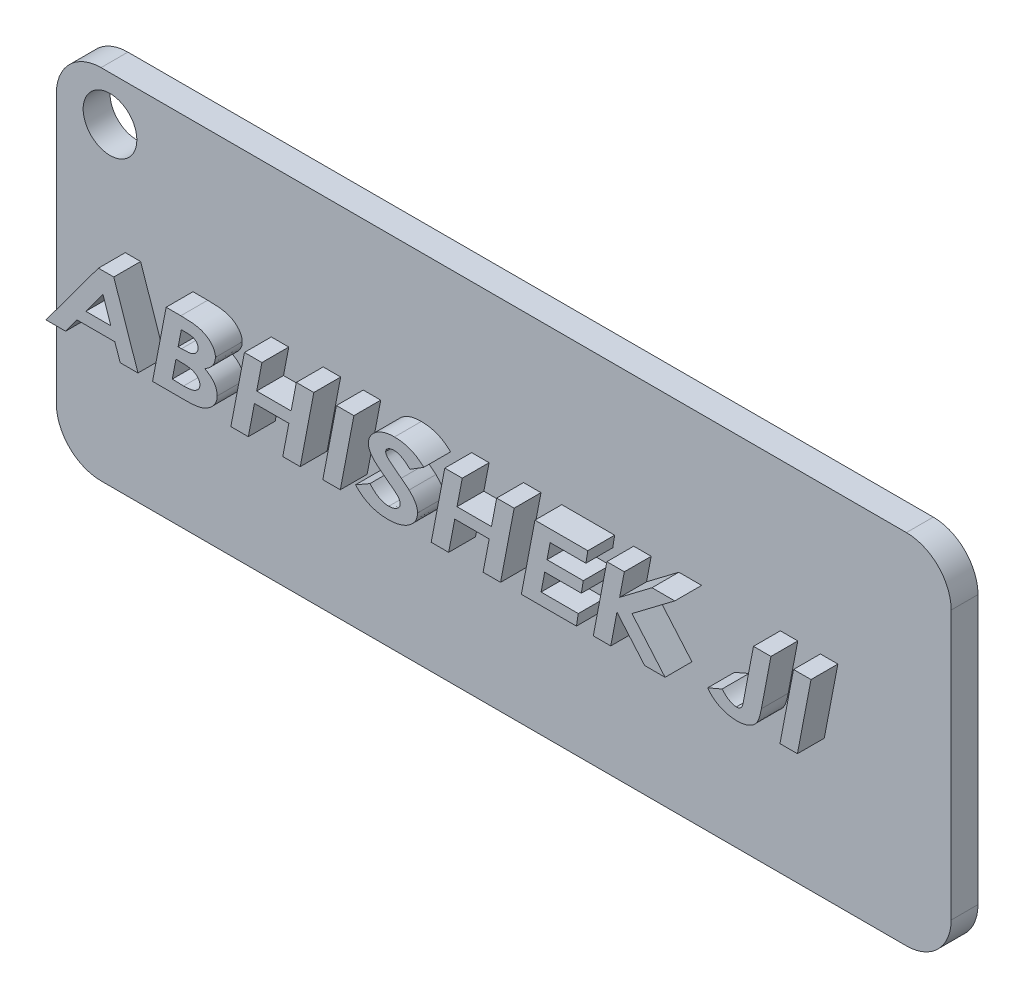
from build123d import *

# Parameters (mm, degrees)
BOSS_EXTRUDE1_DEPTH = 1.5
BOSS_EXTRUDE2_DEPTH = 1.5
SKETCH3_R           = 1.5
CUT_EXTRUDE1_DEPTH  = 1.5


with BuildPart() as part:
    # Sketch1 → Boss-Extrude1 (new body)
    with BuildSketch(Plane.XY):
        with BuildLine():
            Line((-22.5, -10), (22.5, -10))
            ThreePointArc((22.5, -10), (24.267766953, -9.267766953), (25, -7.5))
            Line((25, -7.5), (25, 7.5))
            ThreePointArc((25, 7.5), (24.267766953, 9.267766953), (22.5, 10))
            Line((22.5, 10), (-22.5, 10))
            ThreePointArc((-22.5, 10), (-24.267766953, 9.267766953), (-25, 7.5))
            Line((-25, 7.5), (-25, -7.5))
            ThreePointArc((-25, -7.5), (-24.267766953, -9.267766953), (-22.5, -10))
        make_face()
    extrude(amount=BOSS_EXTRUDE1_DEPTH)

    # Sketch2 → Boss-Extrude2 (add)
    # profile 1 of 10: a face of its own
    with BuildSketch(Plane.XY.offset(1.5)):
        Polygon((-21.146594877, 1.723300812), (-20.289561123, 1.723300812), (-18.937228641, -2.245449188), (-19.934186274, -2.245449188), (-20.228344427, -1.380465214), (-22.340717974, -1.380465214), (-22.979120669, -2.245449188), (-24.076251077, -2.245449188), align=None)
        Polygon((-20.454130685, -0.719006881), (-20.895367914, 0.577674059), (-21.852574445, -0.719006881), align=None, mode=Mode.SUBTRACT)
    # profile 2 of 10: a face of its own
    with BuildSketch(Plane.XY.offset(1.5)):
        with BuildLine():
            Line((-17.363880034, 1.723300812), (-16.541032227, 1.723300812))
            add(Edge.make_bspline(
                [(-16.541032227, 1.723300812), (-16.48033846, 1.723169126), (-16.363153889, 1.722914874), (-16.193512235, 1.716093408), (-16.035804539, 1.706582936), (-15.890079889, 1.694808188), (-15.756542857, 1.676739148), (-15.634915933, 1.656660304), (-15.525161239, 1.632423988), (-15.426479994, 1.603331882), (-15.336365105, 1.570255512), (-15.251696828, 1.533584857), (-15.171304806, 1.492905346), (-15.094798579, 1.448901098), (-15.023554809, 1.399045849), (-14.957168623, 1.344781565), (-14.893624362, 1.287787547), (-14.836314669, 1.225810882), (-14.783663173, 1.161970132), (-14.738246129, 1.09553582), (-14.699206038, 1.028141752), (-14.666968536, 0.959702328), (-14.642960074, 0.889465405), (-14.625804824, 0.818120684), (-14.61371052, 0.745565411), (-14.612776047, 0.696711032), (-14.61230877, 0.672281681)],
                knots=[0, 0, 0, 0, 1.788069285, 3.452317138, 5.001111038, 6.443179535, 7.758358721, 8.970088061, 10.074424941, 11.067590285, 11.998823452, 12.90102893, 13.784457031, 14.652219654, 15.499112109, 16.342939696, 17.177505148, 18.0116322, 18.827432674, 19.613588146, 20.379634812, 21.120189306, 21.838725029, 22.562122777, 23.280997792, 24, 24, 24, 24], degree=3))
            add(Edge.make_bspline(
                [(-14.61230877, 0.672281681), (-14.614126375, 0.631305351), (-14.617747708, 0.549665587), (-14.647738769, 0.429268488), (-14.697171143, 0.313025377), (-14.764786497, 0.200846767), (-14.851350047, 0.095738225), (-14.95505213, -0.000783792), (-15.075175181, -0.089316014), (-15.164732269, -0.138103218), (-15.210960362, -0.163286478)],
                knots=[0, 0, 0, 0, 0.90756848, 1.808206742, 2.732472128, 3.699807128, 4.701884177, 5.741065758, 6.833970308, 8, 8, 8, 8], degree=3))
            add(Edge.make_bspline(
                [(-15.210960362, -0.163286478), (-15.182392977, -0.178557993), (-15.126515237, -0.208429042), (-15.047819073, -0.258559935), (-14.973453665, -0.30890187), (-14.905223749, -0.362647185), (-14.841475106, -0.416921312), (-14.784029487, -0.473709811), (-14.732039486, -0.532159894), (-14.684732423, -0.592179221), (-14.644520582, -0.655555202), (-14.608407515, -0.719809609), (-14.577942738, -0.786228603), (-14.553406862, -0.854621853), (-14.534137827, -0.924788769), (-14.520951891, -0.996895828), (-14.511459128, -1.070684847), (-14.510851843, -1.120727079), (-14.510545949, -1.145933714)],
                knots=[0, 0, 0, 0, 1.219954607, 2.386228456, 3.513383575, 4.601845798, 5.656634142, 6.666225039, 7.642127439, 8.602741412, 9.541575874, 10.466719604, 11.378131008, 12.290853954, 13.201554152, 14.116022893, 15.051027099, 16, 16, 16, 16], degree=3))
            add(Edge.make_bspline(
                [(-14.510545949, -1.145933714), (-14.510995793, -1.172218319), (-14.511890598, -1.22450217), (-14.524054739, -1.30178776), (-14.54086272, -1.377933637), (-14.567068169, -1.451817115), (-14.598517596, -1.524479018), (-14.638159544, -1.595148941), (-14.684922732, -1.663867796), (-14.756296479, -1.75266919), (-14.855594223, -1.856223431), (-14.991524011, -1.962146703), (-15.139778697, -2.052371894), (-15.274838065, -2.111944737), (-15.392074354, -2.151122294), (-15.490155405, -2.176245933), (-15.597654081, -2.197640519), (-15.714482958, -2.214530157), (-15.840340493, -2.229412974), (-15.975684439, -2.23801238), (-16.120390994, -2.245103785), (-16.220097931, -2.245331664), (-16.271519757, -2.245449188)],
                knots=[0, 0, 0, 0, 0.680459984, 1.353532535, 2.023233028, 2.698683934, 3.381358377, 4.073092533, 4.795021277, 5.532942777, 7.023999496, 8.500960618, 9.986185571, 11.511208215, 12.314761941, 13.187612293, 14.133116865, 15.153916582, 16.246036774, 17.416455897, 18.667589635, 20, 20, 20, 20], degree=3))
            Line((-16.271519757, -2.245449188), (-18.123126077, -2.245449188))
            Line((-18.123126077, -2.245449188), (-17.363880034, 1.723300812))
        make_face()
        with BuildLine():
            Line((-16.692086414, 0.145977094), (-16.505256236, 0.145977094))
            add(Edge.make_bspline(
                [(-16.505256236, 0.145977094), (-16.471862219, 0.14608377), (-16.407715195, 0.146288686), (-16.315769581, 0.149096121), (-16.231942824, 0.15151148), (-16.156986081, 0.157542761), (-16.090097509, 0.163462684), (-16.031841355, 0.171660519), (-15.981380259, 0.179516618), (-15.926535697, 0.194620831), (-15.865182692, 0.218152411), (-15.798159002, 0.256475991), (-15.737069454, 0.304983565), (-15.68272328, 0.361863079), (-15.636302386, 0.425151212), (-15.603839136, 0.494374675), (-15.582307677, 0.566587028), (-15.58014691, 0.616211716), (-15.579055565, 0.641275822)],
                knots=[0, 0, 0, 0, 1.353255322, 2.599486752, 3.727981978, 4.751027382, 5.646560469, 6.448528218, 7.135370742, 7.713725776, 8.750824122, 9.789866942, 10.829797453, 11.900818277, 12.970761615, 13.993976123, 14.986810864, 16, 16, 16, 16], degree=3))
            add(Edge.make_bspline(
                [(-15.579055565, 0.641275822), (-15.580031724, 0.664181853), (-15.581957457, 0.70937008), (-15.599972192, 0.774174507), (-15.629392284, 0.834040691), (-15.670279303, 0.887504292), (-15.719316352, 0.935337052), (-15.776603503, 0.974782244), (-15.841207725, 1.004989741), (-15.901082283, 1.023667111), (-15.956413946, 1.035131383), (-16.008012945, 1.041707726), (-16.068971734, 1.04813635), (-16.139476137, 1.053681763), (-16.219807972, 1.057536181), (-16.30967236, 1.059624983), (-16.409052891, 1.061279211), (-16.478489697, 1.061649082), (-16.5147965, 1.061842478)],
                knots=[0, 0, 0, 0, 0.950364965, 1.874847189, 2.771348663, 3.707566675, 4.657867812, 5.60804128, 6.583540349, 7.611183789, 8.207383659, 8.930145273, 9.771859156, 10.755161846, 11.868971456, 13.114029242, 14.490996654, 16, 16, 16, 16], degree=3))
            Line((-16.5147965, 1.061842478), (-16.692086414, 0.145977094))
        make_face(mode=Mode.SUBTRACT)
        with BuildLine():
            Line((-17.020430514, -1.583990855), (-16.387592974, -1.599891296))
            add(Edge.make_bspline(
                [(-16.387592974, -1.599891296), (-16.349157352, -1.599413814), (-16.275146283, -1.598494383), (-16.16824683, -1.592055318), (-16.069230897, -1.581986677), (-15.978255036, -1.56751247), (-15.895672872, -1.546950874), (-15.820591701, -1.524626063), (-15.753491916, -1.497064759), (-15.694758312, -1.46408251), (-15.643944864, -1.427378468), (-15.599132591, -1.388182597), (-15.562053429, -1.344985767), (-15.530076674, -1.299401612), (-15.506392217, -1.249863082), (-15.489553365, -1.197161514), (-15.478864773, -1.141597027), (-15.477821364, -1.103316127), (-15.477292744, -1.083921995)],
                knots=[0, 0, 0, 0, 1.574050954, 3.030969411, 4.384142073, 5.649180323, 6.799517251, 7.867165574, 8.854806879, 9.763499206, 10.618907734, 11.418369588, 12.195340548, 12.94491891, 13.692451605, 14.43381343, 15.206527816, 16, 16, 16, 16], degree=3))
            add(Edge.make_bspline(
                [(-15.477292744, -1.083921995), (-15.478596322, -1.055077218), (-15.481173265, -0.998056214), (-15.508886133, -0.91596278), (-15.55047235, -0.838054875), (-15.610319119, -0.767350967), (-15.682065065, -0.702799308), (-15.767205761, -0.649484286), (-15.862513142, -0.605507711), (-15.951425192, -0.577865141), (-16.032586669, -0.560026347), (-16.107350349, -0.54969952), (-16.194465346, -0.538881112), (-16.294541852, -0.531898498), (-16.407111442, -0.524066968), (-16.532266013, -0.519948215), (-16.670338493, -0.516598871), (-16.766550865, -0.51586521), (-16.816904873, -0.51548124)],
                knots=[0, 0, 0, 0, 0.854638835, 1.689469302, 2.549756069, 3.467858273, 4.427814277, 5.409261632, 6.442243073, 7.541244886, 8.170283165, 8.911344294, 9.784134167, 10.780087848, 11.893374856, 13.139251716, 14.502789806, 16, 16, 16, 16], degree=3))
            Line((-16.816904873, -0.51548124), (-17.020430514, -1.583990855))
        make_face(mode=Mode.SUBTRACT)
    # profile 3 of 10: a face of its own
    with BuildSketch(Plane.XY.offset(1.5)):
        Polygon((-12.988078752, 1.723300812), (-12.011791692, 1.723300812), (-12.304359801, 0.196858504), (-10.380406476, 0.196858504), (-10.087838367, 1.723300812), (-9.111551308, 1.723300812), (-9.870797351, -2.245449188), (-10.847084411, -2.245449188), (-10.506019958, -0.464599829), (-12.429973283, -0.464599829), (-12.771037736, -2.245449188), (-13.747324795, -2.245449188), align=None)
    # profile 4 of 10: a face of its own
    with BuildSketch(Plane.XY.offset(1.5)):
        Polygon((-7.849056316, 1.723300812), (-6.872769256, 1.723300812), (-7.6320153, -2.245449188), (-8.608302359, -2.245449188), align=None)
    # profile 5 of 10: a face of its own
    with BuildSketch(Plane.XY.offset(1.5)):
        with BuildLine():
            Line((-2.970801107, 1.171555519), (-3.74117746, 0.690567188))
            add(Edge.make_bspline(
                [(-3.74117746, 0.690567188), (-3.779951716, 0.727895204), (-3.854791338, 0.799943384), (-3.970525629, 0.896419886), (-4.083760357, 0.97921848), (-4.196461255, 1.045369797), (-4.306474119, 1.097774893), (-4.414478987, 1.135806204), (-4.5208643, 1.159388266), (-4.59147489, 1.162219488), (-4.626036985, 1.163605299)],
                knots=[0, 0, 0, 0, 1.255792826, 2.423852063, 3.513846818, 4.525803334, 5.469269923, 6.353396326, 7.194029221, 8, 8, 8, 8], degree=3))
            add(Edge.make_bspline(
                [(-4.626036985, 1.163605299), (-4.658703194, 1.162575912), (-4.721274972, 1.160604133), (-4.810980225, 1.14454937), (-4.892161445, 1.117750243), (-4.9630128, 1.080131213), (-5.021273426, 1.035243596), (-5.065297166, 0.985791179), (-5.092187105, 0.929875748), (-5.095719069, 0.890650042), (-5.097485052, 0.87103719)],
                knots=[0, 0, 0, 0, 1.286023651, 2.463364759, 3.575796813, 4.640532605, 5.607328288, 6.458761219, 7.229380609, 8, 8, 8, 8], degree=3))
            add(Edge.make_bspline(
                [(-5.097485052, 0.87103719), (-5.095706261, 0.851769035), (-5.091914033, 0.810691011), (-5.06680675, 0.748981782), (-5.027516914, 0.684798056), (-4.982223927, 0.628780675), (-4.930968049, 0.57879291), (-4.877111639, 0.528344265), (-4.805848569, 0.46957852), (-4.719787954, 0.399611384), (-4.619128928, 0.317963338), (-4.500868021, 0.228238157), (-4.368673032, 0.12590388), (-4.274235586, 0.055705709), (-4.224550857, 0.018773568)],
                knots=[0, 0, 0, 0, 0.556397744, 1.186191412, 1.900298587, 2.727526874, 3.257940941, 3.967480088, 4.858340154, 5.924676831, 7.171477809, 8.601414036, 10.21196114, 12, 12, 12, 12], degree=3))
            add(Edge.make_bspline(
                [(-4.224550857, 0.018773568), (-4.19799177, -0.001024827), (-4.147039005, -0.039007421), (-4.074908762, -0.094686768), (-4.00973395, -0.14558829), (-3.951324971, -0.19151603), (-3.900675532, -0.233999945), (-3.856170502, -0.270767076), (-3.819396022, -0.30347659), (-3.797838782, -0.324092251), (-3.78808376, -0.333421194)],
                knots=[0, 0, 0, 0, 1.416789831, 2.718066365, 3.897053452, 4.953822921, 5.8956632, 6.724309647, 7.422728118, 8, 8, 8, 8], degree=3))
            add(Edge.make_bspline(
                [(-3.78808376, -0.333421194), (-3.74860624, -0.372406101), (-3.673163633, -0.446907314), (-3.573378372, -0.561378631), (-3.491405306, -0.672092207), (-3.426640516, -0.779921007), (-3.377141262, -0.885880871), (-3.342466739, -0.992361777), (-3.321047927, -1.09975756), (-3.318098576, -1.172075567), (-3.316635693, -1.207945432)],
                knots=[0, 0, 0, 0, 1.302592048, 2.489288667, 3.56224668, 4.533482695, 5.438434896, 6.302400508, 7.157987527, 8, 8, 8, 8], degree=3))
            add(Edge.make_bspline(
                [(-3.316635693, -1.207945432), (-3.317871436, -1.247552388), (-3.320313484, -1.325822746), (-3.343996916, -1.44024654), (-3.379157961, -1.550270878), (-3.431313135, -1.654771606), (-3.49748402, -1.754428738), (-3.579129733, -1.848653469), (-3.673874769, -1.938802079), (-3.78283805, -2.02208426), (-3.901857247, -2.099368205), (-4.031592477, -2.164873145), (-4.168587761, -2.22168785), (-4.31409552, -2.26778646), (-4.467774169, -2.303465171), (-4.629645142, -2.328300412), (-4.799528105, -2.345101767), (-4.915647458, -2.346497818), (-4.975051658, -2.347212009)],
                knots=[0, 0, 0, 0, 0.850830999, 1.681392697, 2.503323468, 3.329236848, 4.184485799, 5.069804995, 6.005177061, 6.992508657, 8.015475558, 9.052995851, 10.113619022, 11.202401817, 12.331986481, 13.503351326, 14.722767445, 16, 16, 16, 16], degree=3))
            add(Edge.make_bspline(
                [(-4.975051658, -2.347212009), (-5.020645852, -2.346542829), (-5.110857206, -2.345218808), (-5.244595529, -2.336436159), (-5.375164417, -2.321450618), (-5.502457878, -2.299804562), (-5.626627724, -2.272794334), (-5.747763873, -2.240354366), (-5.86564198, -2.201375182), (-5.980114922, -2.155815231), (-6.091791758, -2.105051163), (-6.200090669, -2.04767894), (-6.304995136, -1.983915985), (-6.406839564, -1.914600818), (-6.505784188, -1.840086674), (-6.600504152, -1.758217441), (-6.692833508, -1.6711774), (-6.75118184, -1.608948504), (-6.7805467, -1.577630679)],
                knots=[0, 0, 0, 0, 1.080893467, 2.138624549, 3.175856923, 4.195279432, 5.198367331, 6.187447507, 7.166903322, 8.139890008, 9.106997075, 10.073777582, 11.043493169, 12.015830575, 12.993410713, 13.978091401, 14.982437682, 16, 16, 16, 16], degree=3))
            Line((-6.7805467, -1.577630679), (-5.974394357, -1.115722876))
            add(Edge.make_bspline(
                [(-5.974394357, -1.115722876), (-5.93434075, -1.160966651), (-5.856478826, -1.248917963), (-5.730493661, -1.365154049), (-5.602013395, -1.463751435), (-5.471320687, -1.544986611), (-5.33756017, -1.607639483), (-5.201484829, -1.65239087), (-5.062638094, -1.680997216), (-4.968827411, -1.684165107), (-4.921785182, -1.685753676)],
                knots=[0, 0, 0, 0, 1.172343252, 2.278968287, 3.32119067, 4.311961498, 5.260097778, 6.180807985, 7.087749436, 8, 8, 8, 8], degree=3))
            add(Edge.make_bspline(
                [(-4.921785182, -1.685753676), (-4.878465573, -1.684373533), (-4.79482819, -1.681708885), (-4.674857379, -1.657109954), (-4.565303308, -1.618201309), (-4.482597494, -1.572815759), (-4.425576072, -1.528442811), (-4.386480359, -1.495997168), (-4.355648241, -1.459145782), (-4.328963645, -1.422366453), (-4.308950365, -1.383073234), (-4.293158845, -1.342831132), (-4.285650737, -1.299907648), (-4.284144142, -1.271037161), (-4.283382488, -1.256441776)],
                knots=[0, 0, 0, 0, 1.83650338, 3.545746169, 5.171408482, 6.757417886, 7.519892902, 8.23715658, 8.906821782, 9.552645056, 10.161267624, 10.773309156, 11.379850245, 12, 12, 12, 12], degree=3))
            add(Edge.make_bspline(
                [(-4.283382488, -1.256441776), (-4.284843017, -1.232976617), (-4.287839139, -1.184840308), (-4.310605345, -1.112960066), (-4.348665049, -1.041589878), (-4.391211069, -0.980679254), (-4.438154649, -0.927906844), (-4.487890021, -0.879697945), (-4.550853183, -0.823661272), (-4.626586225, -0.758823511), (-4.716521119, -0.687211615), (-4.819201525, -0.606372789), (-4.936023192, -0.518736571), (-5.018479163, -0.457663206), (-5.06170906, -0.42564375)],
                knots=[0, 0, 0, 0, 0.719628396, 1.476242046, 2.291261698, 3.196314285, 3.749624812, 4.457196724, 5.321287096, 6.336912264, 7.517211616, 8.850037919, 10.348542408, 12, 12, 12, 12], degree=3))
            add(Edge.make_bspline(
                [(-5.06170906, -0.42564375), (-5.107985852, -0.391677583), (-5.19691091, -0.326408508), (-5.32213864, -0.229058327), (-5.435788748, -0.13950241), (-5.537473329, -0.057085024), (-5.625340447, 0.020316812), (-5.702074893, 0.089864139), (-5.766226512, 0.153367075), (-5.803126788, 0.195089688), (-5.820160082, 0.214348989)],
                knots=[0, 0, 0, 0, 1.385807856, 2.662955676, 3.82902573, 4.879237777, 5.822359536, 6.655562538, 7.379403051, 8, 8, 8, 8], degree=3))
            add(Edge.make_bspline(
                [(-5.820160082, 0.214348989), (-5.839594755, 0.238464284), (-5.877347662, 0.285309555), (-5.926750031, 0.358291389), (-5.96941528, 0.430478566), (-6.003383817, 0.503091981), (-6.031094484, 0.574885014), (-6.050129003, 0.646584813), (-6.061719165, 0.718015552), (-6.063397264, 0.765522757), (-6.064231847, 0.78914992)],
                knots=[0, 0, 0, 0, 1.166084785, 2.265182982, 3.316324995, 4.320941583, 5.281242392, 6.210969285, 7.110246096, 8, 8, 8, 8], degree=3))
            add(Edge.make_bspline(
                [(-6.064231847, 0.78914992), (-6.063018597, 0.819678719), (-6.060598697, 0.880570271), (-6.045523619, 0.970693813), (-6.01887048, 1.058137296), (-5.981549134, 1.142766416), (-5.935854631, 1.226111132), (-5.877285635, 1.305643053), (-5.810206452, 1.384061882), (-5.75840514, 1.431772823), (-5.731912636, 1.456173408)],
                knots=[0, 0, 0, 0, 0.95309821, 1.901012588, 2.843133699, 3.799028081, 4.784115705, 5.803481003, 6.876644526, 8, 8, 8, 8], degree=3))
            add(Edge.make_bspline(
                [(-5.731912636, 1.456173408), (-5.696254866, 1.485933651), (-5.624714916, 1.54564143), (-5.504723621, 1.619945754), (-5.376759901, 1.683743168), (-5.239492166, 1.73549905), (-5.093484008, 1.776264906), (-4.938006981, 1.804130306), (-4.77381306, 1.82230755), (-4.66133377, 1.824130699), (-4.603776368, 1.825063632)],
                knots=[0, 0, 0, 0, 0.917495691, 1.840765559, 2.782939718, 3.741657312, 4.73725123, 5.776455855, 6.862177887, 8, 8, 8, 8], degree=3))
            add(Edge.make_bspline(
                [(-4.603776368, 1.825063632), (-4.523921392, 1.823051215), (-4.367069886, 1.819098417), (-4.136821587, 1.788757742), (-3.917256286, 1.736327781), (-3.706540826, 1.666073416), (-3.506480166, 1.573066471), (-3.316212198, 1.460368514), (-3.135693607, 1.327221777), (-3.026230019, 1.223883013), (-2.970801107, 1.171555519)],
                knots=[0, 0, 0, 0, 1.060482133, 2.083003838, 3.077652376, 4.05495983, 5.028246588, 6.001966066, 6.988258587, 8, 8, 8, 8], degree=3))
        make_face()
    # profile 6 of 10: a face of its own
    with BuildSketch(Plane.XY.offset(1.5)):
        Polygon((-1.794168495, 1.723300812), (-0.817881436, 1.723300812), (-1.110449545, 0.196858504), (0.81350378, 0.196858504), (1.106071889, 1.723300812), (2.082358949, 1.723300812), (1.323112905, -2.245449188), (0.346825846, -2.245449188), (0.687890299, -0.464599829), (-1.236063026, -0.464599829), (-1.57712748, -2.245449188), (-2.553414539, -2.245449188), align=None)
    # profile 7 of 10: a face of its own
    with BuildSketch(Plane.XY.offset(1.5)):
        Polygon((3.24309112, 1.723300812), (6.198188025, 1.723300812), (6.091655072, 1.061842478), (4.092174654, 1.061842478), (3.917269806, 0.145977094), (5.944575996, 0.145977094), (5.838043043, -0.51548124), (3.790861302, -0.51548124), (3.586540639, -1.583990855), (5.667113306, -1.583990855), (5.560580353, -2.245449188), (2.483845076, -2.245449188), align=None)
    # profile 8 of 10: a face of its own
    with BuildSketch(Plane.XY.offset(1.5)):
        Polygon((7.26272253, 1.723300812), (8.23900959, 1.723300812), (7.978242362, 0.356657933), (9.783737404, 1.723300812), (11.057362705, 1.723300812), (8.665141401, -0.086169341), (10.515952699, -2.245449188), (9.374301056, -2.245449188), (7.825598131, -0.43756908), (7.479763546, -2.245449188), (6.503476487, -2.245449188), align=None)
    # profile 9 of 10: a face of its own
    with BuildSketch(Plane.XY.offset(1.5)):
        with BuildLine():
            Line((15.454629582, 1.723300812), (16.430916641, 1.723300812))
            Line((16.430916641, 1.723300812), (15.895866811, -1.075971774))
            add(Edge.make_bspline(
                [(15.895866811, -1.075971774), (15.887383909, -1.12081121), (15.871024727, -1.207283549), (15.843159823, -1.331362471), (15.813957412, -1.445180058), (15.782928478, -1.548881293), (15.750669896, -1.642668311), (15.716627585, -1.726372513), (15.681121178, -1.799902144), (15.631332064, -1.883745667), (15.5593091, -1.976544393), (15.456408146, -2.073664786), (15.335581133, -2.156826813), (15.198323268, -2.225352625), (15.047090165, -2.280237424), (14.882689225, -2.31858646), (14.706452736, -2.343049507), (14.584695298, -2.345798203), (14.522068734, -2.347212009)],
                knots=[0, 0, 0, 0, 1.04160682, 2.008726867, 2.902235874, 3.723245156, 4.478899794, 5.165253871, 5.784778404, 6.340836054, 7.388659909, 8.45414496, 9.558269068, 10.724241842, 11.947015182, 13.222014851, 14.571129077, 16, 16, 16, 16], degree=3))
            add(Edge.make_bspline(
                [(14.522068734, -2.347212009), (14.482032275, -2.346620736), (14.402639813, -2.34544824), (14.284023285, -2.33540416), (14.166940692, -2.319828318), (14.051006296, -2.297261303), (13.93678446, -2.268939119), (13.823901939, -2.233352307), (13.712221577, -2.192524785), (13.602810974, -2.144575017), (13.496089198, -2.091962788), (13.395067455, -2.03191164), (13.297770754, -1.968731378), (13.207508408, -1.898047349), (13.120780209, -1.823425598), (13.040511769, -1.742242958), (12.963696201, -1.656941854), (12.917794682, -1.595752175), (12.894658628, -1.564910326)],
                knots=[0, 0, 0, 0, 1.025550465, 2.033670776, 3.047626854, 4.050268272, 5.058022726, 6.060848022, 7.08117134, 8.102826512, 9.119982522, 10.127210822, 11.112040104, 12.089799821, 13.061885836, 14.041247126, 15.012716501, 16, 16, 16, 16], degree=3))
            Line((12.894658628, -1.564910326), (13.701605994, -1.218280719))
            add(Edge.make_bspline(
                [(13.701605994, -1.218280719), (13.736504314, -1.257031302), (13.803673417, -1.331614889), (13.910283916, -1.429656448), (14.016574843, -1.510722312), (14.121432496, -1.57569165), (14.22377467, -1.623908436), (14.320397944, -1.658530956), (14.411072973, -1.680977201), (14.470015506, -1.684207876), (14.498218073, -1.685753676)],
                knots=[0, 0, 0, 0, 1.318038558, 2.536840381, 3.655870518, 4.693607722, 5.649761493, 6.510215881, 7.287174572, 8, 8, 8, 8], degree=3))
            add(Edge.make_bspline(
                [(14.498218073, -1.685753676), (14.525668393, -1.684749666), (14.578193976, -1.682828517), (14.651678972, -1.662327517), (14.716570888, -1.629854715), (14.750163581, -1.597142906), (14.766935521, -1.580810767)],
                knots=[0, 0, 0, 0, 1.105913873, 2.116141862, 3.059439575, 4, 4, 4, 4], degree=3))
            add(Edge.make_bspline(
                [(14.766935521, -1.580810767), (14.774838041, -1.570900374), (14.791784878, -1.54964768), (14.814327789, -1.511735828), (14.833155551, -1.465233122), (14.852733607, -1.412210372), (14.868894612, -1.350820314), (14.884779624, -1.28220293), (14.899091098, -1.205542018), (14.906800528, -1.151795907), (14.91083451, -1.123673097)],
                knots=[0, 0, 0, 0, 0.62708379, 1.344772032, 2.17331396, 3.106938369, 4.1413012, 5.312375327, 6.593692538, 8, 8, 8, 8], degree=3))
            Line((14.91083451, -1.123673097), (15.454629582, 1.723300812))
        make_face()
    # profile 10 of 10: a face of its own
    with BuildSketch(Plane.XY.offset(1.5)):
        Polygon((17.693411633, 1.723300812), (18.669698692, 1.723300812), (17.910452649, -2.245449188), (16.934165589, -2.245449188), align=None)
    extrude(amount=BOSS_EXTRUDE2_DEPTH)

    # Sketch3 → Cut-Extrude1 (cut)
    with BuildSketch(Plane.XY.offset(1.5)):
        with Locations((-22, 7.5)):
            Circle(SKETCH3_R)
    extrude(amount=-CUT_EXTRUDE1_DEPTH, mode=Mode.SUBTRACT)


solid = part.part
